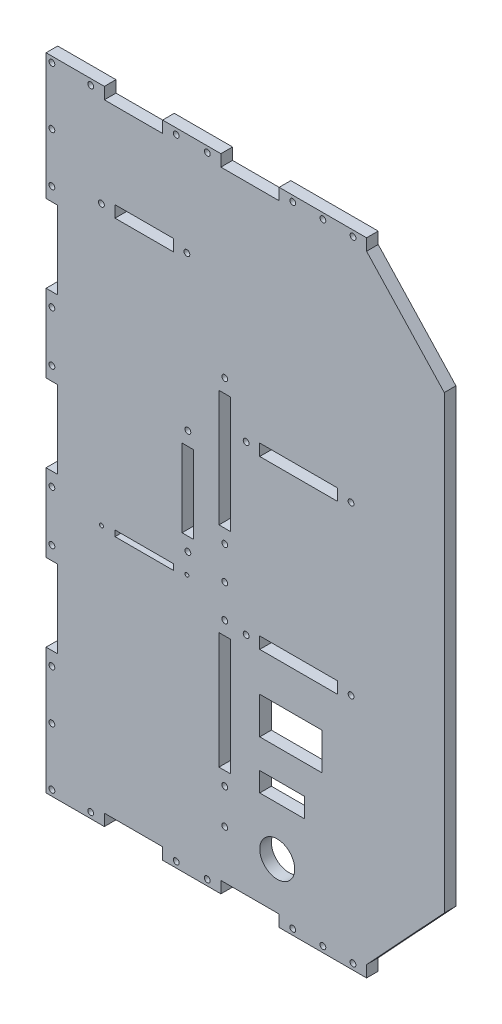
from build123d import *

# Parameters (mm, degrees)
ESQUISSE1_W             = 148
ESQUISSE1_H             = 330
BOSS_EXTRU_1_DEPTH      = 6
ESQUISSE2_W             = 30
ESQUISSE2_H             = 6
ESQUISSE2_W_2           = 6
ESQUISSE2_H_2           = 40
ENL_V_MAT_EXTRU_1_DEPTH = 6
ESQUISSE5_R             = 9
ESQUISSE5_W             = 30
ESQUISSE5_H             = 6
ESQUISSE5_W_2           = 32
ESQUISSE5_H_2           = 19
ESQUISSE5_W_3           = 23
ESQUISSE5_H_3           = 10
ESQUISSE5_H_4           = 3
ENL_V_MAT_EXTRU_3_DEPTH = 6
ESQUISSE6_W             = 6
ESQUISSE6_H             = 60
ENL_V_MAT_EXTRU_4_DEPTH = 10
ESQUISSE8_W             = 6
ESQUISSE8_H             = 330
BOSS_EXTRU_2_DEPTH      = 57
ENL_V_MAT_EXTRU_5_DEPTH = 389.536999525
ESQUISSE10_W            = 6
ESQUISSE10_H            = 40
ESQUISSE10_W_2          = 40
ESQUISSE10_H_2          = 6
ENL_V_MAT_EXTRU_6_DEPTH = 389.536999525
ESQUISSE11_R            = 1.5
ESQUISSE11_R_2          = 1.005
ENL_V_MAT_EXTRU_7_DEPTH = 389.536999525
ESQUISSE12_R            = 2.995
ESQUISSE12_R_2          = 3
ESQUISSE12_R_3          = 2
ENL_V_MAT_EXTRU_8_DEPTH = 3


with BuildPart() as part:
    # Esquisse1 → Boss.-Extru.1 (new body)
    with BuildSketch(Plane.XY):
        with Locations((74, 165)):
            Rectangle(ESQUISSE1_W, ESQUISSE1_H)
    extrude(amount=BOSS_EXTRU_1_DEPTH)

    # Esquisse2 → Enlèv. mat.-Extru.1 (cut)
    with BuildSketch(Plane.XY.offset(6)):
        with Locations((45, 3)):
            Rectangle(ESQUISSE2_W, ESQUISSE2_H)
        with Locations((105, 3)):
            Rectangle(ESQUISSE2_W, ESQUISSE2_H)
        with Locations((45, 327)):
            Rectangle(ESQUISSE2_W, ESQUISSE2_H)
        with Locations((105, 327)):
            Rectangle(ESQUISSE2_W, ESQUISSE2_H)
        with Locations((3, 245)):
            Rectangle(ESQUISSE2_W_2, ESQUISSE2_H_2)
        with Locations((3, 165)):
            Rectangle(ESQUISSE2_W_2, ESQUISSE2_H_2)
        with Locations((3, 85)):
            Rectangle(ESQUISSE2_W_2, ESQUISSE2_H_2)
    extrude(amount=-ENL_V_MAT_EXTRU_1_DEPTH, mode=Mode.SUBTRACT)

    # Esquisse5 → Enlèv. mat.-Extru.3 (cut)
    with BuildSketch(Plane.XY.offset(6)):
        with Locations((119, 30)):
            Circle(ESQUISSE5_R)
        with Locations((50.5, 277)):
            Rectangle(ESQUISSE5_W, ESQUISSE5_H)
        with Locations((126, 89.5)):
            Rectangle(ESQUISSE5_W_2, ESQUISSE5_H_2)
        with Locations((121.5, 60)):
            Rectangle(ESQUISSE5_W_3, ESQUISSE5_H_3)
        with Locations((50.5, 133.5)):
            Rectangle(ESQUISSE5_W, ESQUISSE5_H_4)
    extrude(amount=-ENL_V_MAT_EXTRU_3_DEPTH, mode=Mode.SUBTRACT)

    # Esquisse6 → Enlèv. mat.-Extru.4 (cut)
    with BuildSketch(Plane.XY.offset(6)):
        with Locations((92, 86)):
            Rectangle(ESQUISSE6_W, ESQUISSE6_H)
        with Locations((92, 194)):
            Rectangle(ESQUISSE6_W, ESQUISSE6_H)
    extrude(amount=-ENL_V_MAT_EXTRU_4_DEPTH, mode=Mode.SUBTRACT)

    # Esquisse8 → Boss.-Extru.2 (add)
    with BuildSketch(Plane(origin=(148, 0, 0), x_dir=(0, 0, -1), z_dir=(1, 0, 0))):
        with Locations((-3, 165)):
            Rectangle(ESQUISSE8_W, ESQUISSE8_H)
    extrude(amount=BOSS_EXTRU_2_DEPTH)

    # Esquisse9 → Enlèv. mat.-Extru.5 (cut, through all)
    with BuildSketch(Plane.XY.offset(6)):
        Polygon((165, 0), (205, 0), (205, 49), (165, 6), align=None)
        Polygon((165, 330), (205, 330), (205, 281), (165, 324), align=None)
    extrude(amount=-ENL_V_MAT_EXTRU_5_DEPTH, mode=Mode.SUBTRACT)

    # Esquisse10 → Enlèv. mat.-Extru.6 (cut, through all)
    with BuildSketch(Plane.XY.offset(6)):
        with Locations((73, 171)):
            Rectangle(ESQUISSE10_W, ESQUISSE10_H)
        with Locations((130, 208)):
            Rectangle(ESQUISSE10_W_2, ESQUISSE10_H_2)
        with Locations((130, 122)):
            Rectangle(ESQUISSE10_W_2, ESQUISSE10_H_2)
    extrude(amount=-ENL_V_MAT_EXTRU_6_DEPTH, mode=Mode.SUBTRACT)

    # Esquisse11 → Enlèv. mat.-Extru.7 (cut, through all)
    with BuildSketch(Plane.XY.offset(6)):
        with Locations((158, 327)):
            Circle(ESQUISSE11_R)
        with Locations((142.5, 327)):
            Circle(ESQUISSE11_R)
        with Locations((127, 327)):
            Circle(ESQUISSE11_R)
        with Locations((67, 327)):
            Circle(ESQUISSE11_R)
        with Locations((83, 327)):
            Circle(ESQUISSE11_R)
        with Locations((3, 327)):
            Circle(ESQUISSE11_R)
        with Locations((23, 327)):
            Circle(ESQUISSE11_R)
        with Locations((3, 297.5)):
            Circle(ESQUISSE11_R)
        with Locations((3, 272)):
            Circle(ESQUISSE11_R)
        with Locations((3, 218)):
            Circle(ESQUISSE11_R)
        with Locations((3, 192)):
            Circle(ESQUISSE11_R)
        with Locations((3, 138)):
            Circle(ESQUISSE11_R)
        with Locations((3, 112)):
            Circle(ESQUISSE11_R)
        with Locations((3, 58)):
            Circle(ESQUISSE11_R)
        with Locations((3, 3)):
            Circle(ESQUISSE11_R)
        with Locations((3, 32.5)):
            Circle(ESQUISSE11_R)
        with Locations((23, 3)):
            Circle(ESQUISSE11_R)
        with Locations((67, 3)):
            Circle(ESQUISSE11_R)
        with Locations((83, 3)):
            Circle(ESQUISSE11_R)
        with Locations((127, 3)):
            Circle(ESQUISSE11_R)
        with Locations((158, 3)):
            Circle(ESQUISSE11_R)
        with Locations((142.5, 3)):
            Circle(ESQUISSE11_R)
        with Locations((92, 231)):
            Circle(ESQUISSE11_R)
        with Locations((92, 157)):
            Circle(ESQUISSE11_R)
        with Locations((92, 123)):
            Circle(ESQUISSE11_R)
        with Locations((92, 49)):
            Circle(ESQUISSE11_R)
        with Locations((92, 140)):
            Circle(ESQUISSE11_R)
        with Locations((73, 144)):
            Circle(ESQUISSE11_R)
        with Locations((73, 198)):
            Circle(ESQUISSE11_R)
        with Locations((28.5, 133.5)):
            Circle(ESQUISSE11_R_2)
        with Locations((72.5, 133.5)):
            Circle(ESQUISSE11_R_2)
        with Locations((72.5, 277)):
            Circle(ESQUISSE11_R)
        with Locations((28.5, 277)):
            Circle(ESQUISSE11_R)
        with Locations((92, 31)):
            Circle(ESQUISSE11_R)
        with Locations((103, 208)):
            Circle(ESQUISSE11_R)
        with Locations((157, 208)):
            Circle(ESQUISSE11_R)
        with Locations((157, 122)):
            Circle(ESQUISSE11_R)
        with Locations((103, 122)):
            Circle(ESQUISSE11_R)
    extrude(amount=-ENL_V_MAT_EXTRU_7_DEPTH, mode=Mode.SUBTRACT)

    # Esquisse12 → Enlèv. mat.-Extru.8 (cut)
    with BuildSketch(Plane(origin=(0, 0, 0), x_dir=(-1, 0, 0), z_dir=(0, 0, -1))):
        with Locations((-158, 327)):
            Circle(ESQUISSE12_R)
        with Locations((-142.5, 327)):
            Circle(ESQUISSE12_R)
        with Locations((-127, 327)):
            Circle(ESQUISSE12_R)
        with Locations((-83, 327)):
            Circle(ESQUISSE12_R)
        with Locations((-67, 327)):
            Circle(ESQUISSE12_R)
        with Locations((-23, 327)):
            Circle(ESQUISSE12_R)
        with Locations((-3, 327)):
            Circle(ESQUISSE12_R)
        with Locations((-3, 297.5)):
            Circle(ESQUISSE12_R)
        with Locations((-3, 272)):
            Circle(ESQUISSE12_R)
        with Locations((-28.5, 277)):
            Circle(ESQUISSE12_R_2)
        with Locations((-72.5, 277)):
            Circle(ESQUISSE12_R_2)
        with Locations((-92, 231)):
            Circle(ESQUISSE12_R_2)
        with Locations((-103, 208)):
            Circle(ESQUISSE12_R_2)
        with Locations((-73, 144)):
            Circle(ESQUISSE12_R_2)
        with Locations((-3, 218)):
            Circle(ESQUISSE12_R)
        with Locations((-3, 192)):
            Circle(ESQUISSE12_R)
        with Locations((-73, 198)):
            Circle(ESQUISSE12_R_2)
        with Locations((-92, 157)):
            Circle(ESQUISSE12_R_2)
        with Locations((-92, 140)):
            Circle(ESQUISSE12_R_2)
        with Locations((-92, 123)):
            Circle(ESQUISSE12_R_2)
        with Locations((-72.5, 133.5)):
            Circle(ESQUISSE12_R_3)
        with Locations((-28.5, 133.5)):
            Circle(ESQUISSE12_R_3)
        with Locations((-3, 112)):
            Circle(ESQUISSE12_R)
        with Locations((-3, 138)):
            Circle(ESQUISSE12_R)
        with Locations((-3, 58)):
            Circle(ESQUISSE12_R)
        with Locations((-3, 32.5)):
            Circle(ESQUISSE12_R)
        with Locations((-3, 3)):
            Circle(ESQUISSE12_R)
        with Locations((-23, 3)):
            Circle(ESQUISSE12_R)
        with Locations((-67, 3)):
            Circle(ESQUISSE12_R)
        with Locations((-83, 3)):
            Circle(ESQUISSE12_R)
        with Locations((-92, 31)):
            Circle(ESQUISSE12_R_2)
        with Locations((-92, 49)):
            Circle(ESQUISSE12_R_2)
        with Locations((-127, 3)):
            Circle(ESQUISSE12_R)
        with Locations((-142.5, 3)):
            Circle(ESQUISSE12_R)
        with Locations((-157, 208)):
            Circle(ESQUISSE12_R_2)
        with Locations((-158, 3)):
            Circle(ESQUISSE12_R)
        with Locations((-157, 122)):
            Circle(ESQUISSE12_R_2)
        with Locations((-103, 122)):
            Circle(ESQUISSE12_R_2)
    extrude(amount=-ENL_V_MAT_EXTRU_8_DEPTH, mode=Mode.SUBTRACT)


solid = part.part
